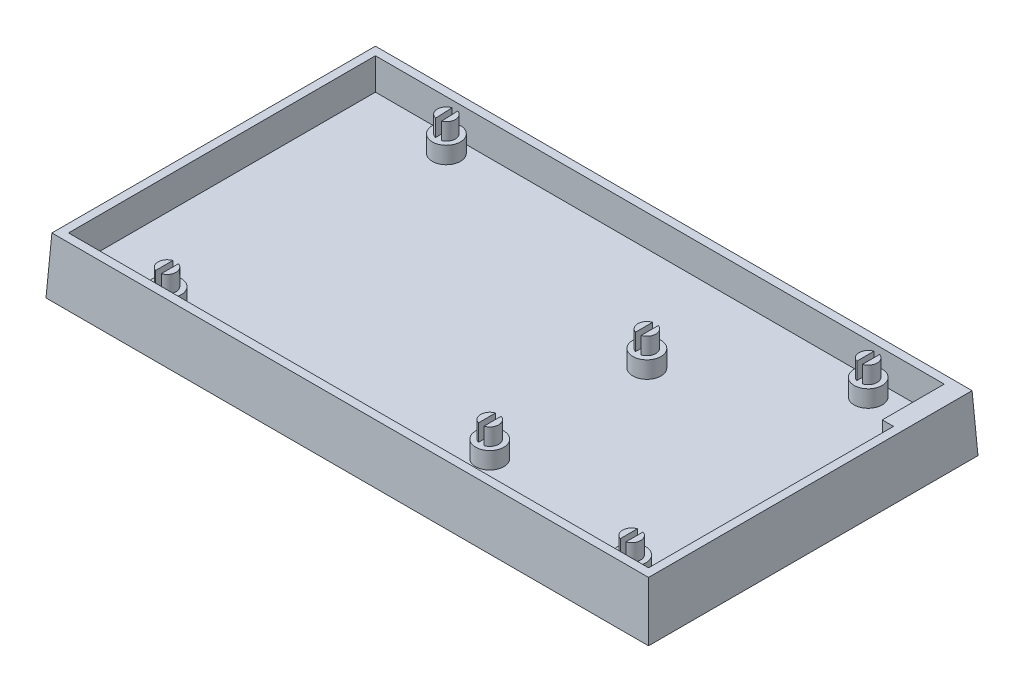
from build123d import *

# Parameters (mm, degrees)
SKETCH2_W           = 107
SKETCH2_H           = 58.5
BOSS_EXTRUDE1_DEPTH = 10
BOSS_EXTRUDE1_TAPER = 3
CUT_EXTRUDE1_START  = 10
SKETCH2_5_W         = 2
SKETCH2_5_H         = 1
CUT_EXTRUDE1_DEPTH  = 5.6
SKETCH8_W           = 107
SKETCH8_H           = 58.5
BOSS_EXTRUDE2_DEPTH = 5
BOSS_EXTRUDE2_TAPER = 45
SKETCH9_W           = 4.1
SKETCH9_H           = 20.1
BOSS_EXTRUDE3_DEPTH = 5
CHAMFER1_SIZE       = 2
SKETCH10_R          = 2.5
BOSS_EXTRUDE4_DEPTH = 3
BOSS_EXTRUDE5_START = 3
BOSS_EXTRUDE5_DEPTH = 3


with BuildPart() as part:
    # Sketch2 → Boss-Extrude1 (new body)
    with BuildSketch(Plane(origin=(0, 0, 0), x_dir=(1, 0, 0), z_dir=(0, 1, 0))):
        with Locations((51.5, 27.25)):
            Rectangle(SKETCH2_W, SKETCH2_H)
    extrude(amount=BOSS_EXTRUDE1_DEPTH, taper=BOSS_EXTRUDE1_TAPER)

    # Sketch2<5> → Cut-Extrude1 (cut)
    with BuildSketch(Plane(origin=(0, 0, 0), x_dir=(1, 0, 0), z_dir=(0, 1, 0)).offset(CUT_EXTRUDE1_START)):
        Polygon((0, 0), (101, 0), (101, 1), (103, 3), (103, 41.5), (101, 43.5), (101, 54.5), (0, 54.5), align=None)
        Polygon((103, 43.5), (101, 43.5), (103, 41.5), align=None)
        Polygon((103, 3), (101, 1), (103, 1), align=None)
        with Locations((102, 0.5)):
            Rectangle(SKETCH2_5_W, SKETCH2_5_H)
    extrude(amount=-CUT_EXTRUDE1_DEPTH, mode=Mode.SUBTRACT)

    # Sketch8 → Boss-Extrude2 (add)
    with BuildSketch(Plane.XZ):
        with Locations((51.5, -27.25)):
            Rectangle(SKETCH8_W, SKETCH8_H)
    extrude(amount=BOSS_EXTRUDE2_DEPTH, taper=BOSS_EXTRUDE2_TAPER)

    # Sketch9 → Boss-Extrude3 (add)
    with BuildSketch(Plane.XZ.offset(5)):
        with Locations((26.5, -27.25)):
            Rectangle(SKETCH9_W, SKETCH9_H)
        with Locations((76.5, -27.25)):
            Rectangle(SKETCH9_W, SKETCH9_H)
    extrude(amount=BOSS_EXTRUDE3_DEPTH)

    # Chamfer1
    chamfer1_edges = [part.edges().sort_by_distance(p)[0] for p in [
        (26.5, -10, -17.2),
        (76.5, -10, -17.2),
    ]]
    chamfer(chamfer1_edges, length=CHAMFER1_SIZE)

    # Sketch10 → Boss-Extrude4 (add)
    # profile 1 of 6: a face of its own
    with BuildSketch(Plane(origin=(0, 4.4, 0), x_dir=(1, 0, 0), z_dir=(0, 1, 0))):
        with Locations(Location((15.7, 51.4, 0), (0, 0, 270))):
            Circle(SKETCH10_R)
    # profile 2 of 6: a face of its own
    with BuildSketch(Plane(origin=(0, 4.4, 0), x_dir=(1, 0, 0), z_dir=(0, 1, 0))):
        with Locations(Location((90.6, 51.4, 0), (0, 0, 270))):
            Circle(SKETCH10_R)
    # profile 3 of 6: a face of its own
    with BuildSketch(Plane(origin=(0, 4.4, 0), x_dir=(1, 0, 0), z_dir=(0, 1, 0))):
        with Locations(Location((66.5, 8.3, 0), (0, 0, 270))):
            Circle(SKETCH10_R)
    # profile 4 of 6: a face of its own
    with BuildSketch(Plane(origin=(0, 4.4, 0), x_dir=(1, 0, 0), z_dir=(0, 1, 0))):
        with Locations(Location((66.5, 36.2, 0), (0, 0, 270))):
            Circle(SKETCH10_R)
    # profile 5 of 6: a face of its own
    with BuildSketch(Plane(origin=(0, 4.4, 0), x_dir=(1, 0, 0), z_dir=(0, 1, 0))):
        with Locations(Location((96.9, 3.1, 0), (0, 0, 270))):
            Circle(SKETCH10_R)
        with BuildLine():
            ThreePointArc((96.4, 4.619868415), (96.9, 4.7), (97.4, 4.619868415))
            ThreePointArc((97.4, 4.619868415), (96.9, 1.5), (96.4, 4.619868415))
        make_face(mode=Mode.SUBTRACT)
    # profile 6 of 6: a face of its own
    with BuildSketch(Plane(origin=(0, 4.4, 0), x_dir=(1, 0, 0), z_dir=(0, 1, 0))):
        with Locations(Location((14.4, 3.1, 0), (0, 0, 270))):
            Circle(SKETCH10_R)
        with BuildLine():
            ThreePointArc((13.9, 1.580131585), (12.8, 3.1), (13.9, 4.619868415))
            ThreePointArc((13.9, 4.619868415), (14.4, 4.7), (14.9, 4.619868415))
            ThreePointArc((14.9, 4.619868415), (16, 3.1), (14.9, 1.580131585))
            ThreePointArc((14.9, 1.580131585), (14.4, 1.5), (13.9, 1.580131585))
        make_face(mode=Mode.SUBTRACT)
    extrude(amount=BOSS_EXTRUDE4_DEPTH)

    # Sketch10<3> → Boss-Extrude5 (add)
    with BuildSketch(Plane(origin=(0, 4.4, 0), x_dir=(1, 0, 0), z_dir=(0, 1, 0)).offset(BOSS_EXTRUDE5_START)):
        with BuildLine():
            ThreePointArc((17.3, 51.4), (16.997366288, 52.336397733), (16.203949106, 52.918563564))
            Line((16.203949106, 52.918563564), (16.332025214, 49.930121049))
            ThreePointArc((16.332025214, 49.930121049), (17.036270995, 50.520011461), (17.3, 51.4))
        make_face()
        with BuildLine():
            Line((15.334874522, 49.842218441), (15.202934006, 52.920830496))
            ThreePointArc((15.202934006, 52.920830496), (14.101467367, 51.331491459), (15.334874522, 49.842218441))
        make_face()
        with BuildLine():
            ThreePointArc((92.2, 51.4), (91.89614814, 52.338083152), (91.1, 52.919868415))
            Line((91.1, 52.919868415), (91.1, 49.880131585))
            ThreePointArc((91.1, 49.880131585), (91.89614814, 50.461916848), (92.2, 51.4))
        make_face()
        with BuildLine():
            Line((90.1, 49.880131585), (90.1, 52.919868415))
            ThreePointArc((90.1, 52.919868415), (89, 51.4), (90.1, 49.880131585))
        make_face()
        with BuildLine():
            ThreePointArc((16, 3.1), (15.69614814, 4.038083152), (14.9, 4.619868415))
            Line((14.9, 4.619868415), (14.9, 1.580131585))
            ThreePointArc((14.9, 1.580131585), (15.69614814, 2.161916848), (16, 3.1))
        make_face()
        with BuildLine():
            Line((13.9, 1.580131585), (13.9, 4.619868415))
            ThreePointArc((13.9, 4.619868415), (12.8, 3.1), (13.9, 1.580131585))
        make_face()
        with BuildLine():
            ThreePointArc((68.1, 36.2), (67.79614814, 37.138083152), (67, 37.719868415))
            Line((67, 37.719868415), (67, 34.680131585))
            ThreePointArc((67, 34.680131585), (67.79614814, 35.261916848), (68.1, 36.2))
        make_face()
        with BuildLine():
            Line((66, 34.680131585), (66, 37.719868415))
            ThreePointArc((66, 37.719868415), (64.9, 36.2), (66, 34.680131585))
        make_face()
        with BuildLine():
            ThreePointArc((68.1, 8.3), (67.79614814, 9.238083152), (67, 9.819868415))
            Line((67, 9.819868415), (67, 6.780131585))
            ThreePointArc((67, 6.780131585), (67.79614814, 7.361916848), (68.1, 8.3))
        make_face()
        with BuildLine():
            Line((66, 6.780131585), (66, 9.819868415))
            ThreePointArc((66, 9.819868415), (64.9, 8.3), (66, 6.780131585))
        make_face()
        with BuildLine():
            ThreePointArc((98.5, 3.1), (98.19614814, 4.038083152), (97.4, 4.619868415))
            Line((97.4, 4.619868415), (97.4, 1.580131585))
            ThreePointArc((97.4, 1.580131585), (98.19614814, 2.161916848), (98.5, 3.1))
        make_face()
        with BuildLine():
            Line((96.4, 1.580131585), (96.4, 4.619868415))
            ThreePointArc((96.4, 4.619868415), (95.3, 3.1), (96.4, 1.580131585))
        make_face()
    extrude(amount=BOSS_EXTRUDE5_DEPTH)


with BuildPart() as boss_extrude5_piece_1:
    # of the separate pieces the step leaves, piece 1, a body of its own (boss_extrude5_pieces)
    add(part.part.solids().sort_by_distance((78.55, -8, -17.2))[0])


with BuildPart() as boss_extrude5_piece_2:
    # of the separate pieces the step leaves, piece 2, a body of its own (boss_extrude5_pieces)
    add(part.part.solids().sort_by_distance((96.4, 10.4, -4.619868415))[0])


with BuildPart() as boss_extrude5_piece_3:
    # of the separate pieces the step leaves, piece 3, a body of its own (boss_extrude5_pieces)
    add(part.part.solids().sort_by_distance((13.9, 10.4, -4.619868415))[0])


with BuildPart() as boss_extrude5_piece_4:
    # of the separate pieces the step leaves, piece 4, a body of its own (boss_extrude5_pieces)
    add(part.part.solids().sort_by_distance((97.4, 10.4, -1.580131585))[0])


with BuildPart() as boss_extrude5_piece_5:
    # of the separate pieces the step leaves, piece 5, a body of its own (boss_extrude5_pieces)
    add(part.part.solids().sort_by_distance((14.9, 10.4, -1.580131585))[0])


solid = Compound([boss_extrude5_piece_1.part, boss_extrude5_piece_2.part, boss_extrude5_piece_3.part, boss_extrude5_piece_4.part, boss_extrude5_piece_5.part])
